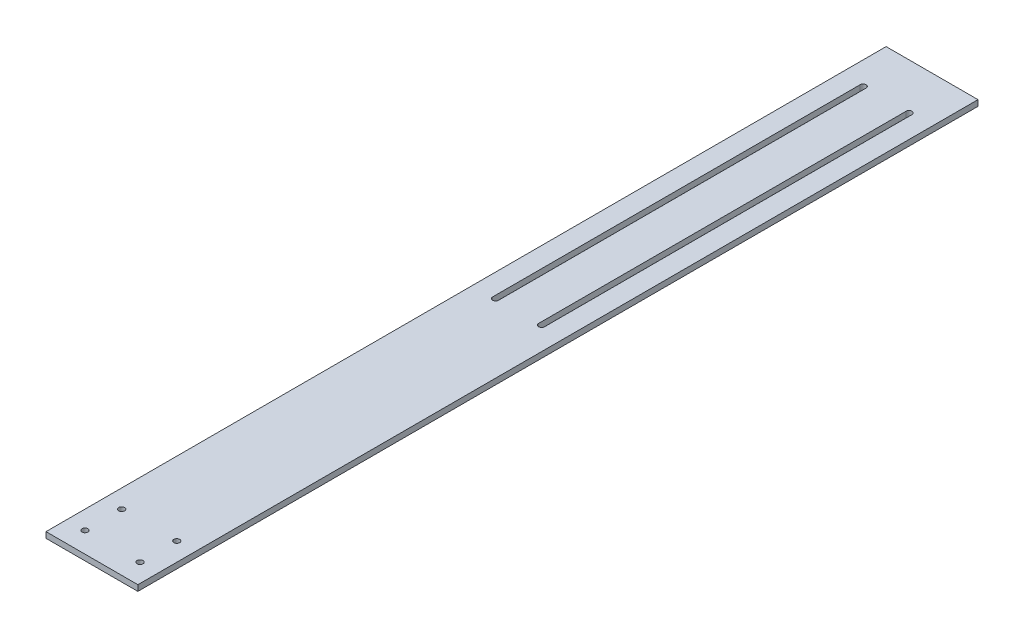
from build123d import *

# Parameters (mm, degrees)
SKETCH1_W            = 50
SKETCH1_H            = 457.2
BOSS_EXTRUDE1_DEPTH  = 3.175
CUT_EXTRUDE1_DEPTH   = 230.984870426
M3_CLEARANCE_HOLE1_D = 3.2


with BuildPart() as part:
    # Sketch1 → Boss-Extrude1 (new body)
    with BuildSketch(Plane(origin=(0, 0, 0), x_dir=(1, 0, 0), z_dir=(0, 1, 0))):
        Rectangle(SKETCH1_W, SKETCH1_H)
    extrude(amount=BOSS_EXTRUDE1_DEPTH)

    # Sketch2 → Cut-Extrude1 (cut, through all)
    with BuildSketch(Plane.XZ):
        with BuildLine():
            Line((-10.9, -3.6), (-10.9, -203.6))
            ThreePointArc((-10.9, -203.6), (-12.5, -205.2), (-14.1, -203.6))
            Line((-14.1, -203.6), (-14.1, -3.6))
            ThreePointArc((-14.1, -3.6), (-12.5, -2), (-10.9, -3.6))
        make_face()
        with BuildLine():
            Line((10.9, -3.6), (10.9, -203.6))
            ThreePointArc((10.9, -203.6), (12.5, -205.2), (14.1, -203.6))
            Line((14.1, -203.6), (14.1, -3.6))
            ThreePointArc((14.1, -3.6), (12.5, -2), (10.9, -3.6))
        make_face()
    extrude(amount=-CUT_EXTRUDE1_DEPTH, mode=Mode.SUBTRACT)

    # M3 Clearance Hole1 (through all)
    with Locations(Plane(origin=(0, 0, 0), x_dir=(-1, 0, 0), z_dir=(0, -1, 0))):
        with Locations((15, -217.425), (-15, -197.425), (-15, -217.425), (15, -197.425)):
            Hole(M3_CLEARANCE_HOLE1_D / 2)


solid = part.part
